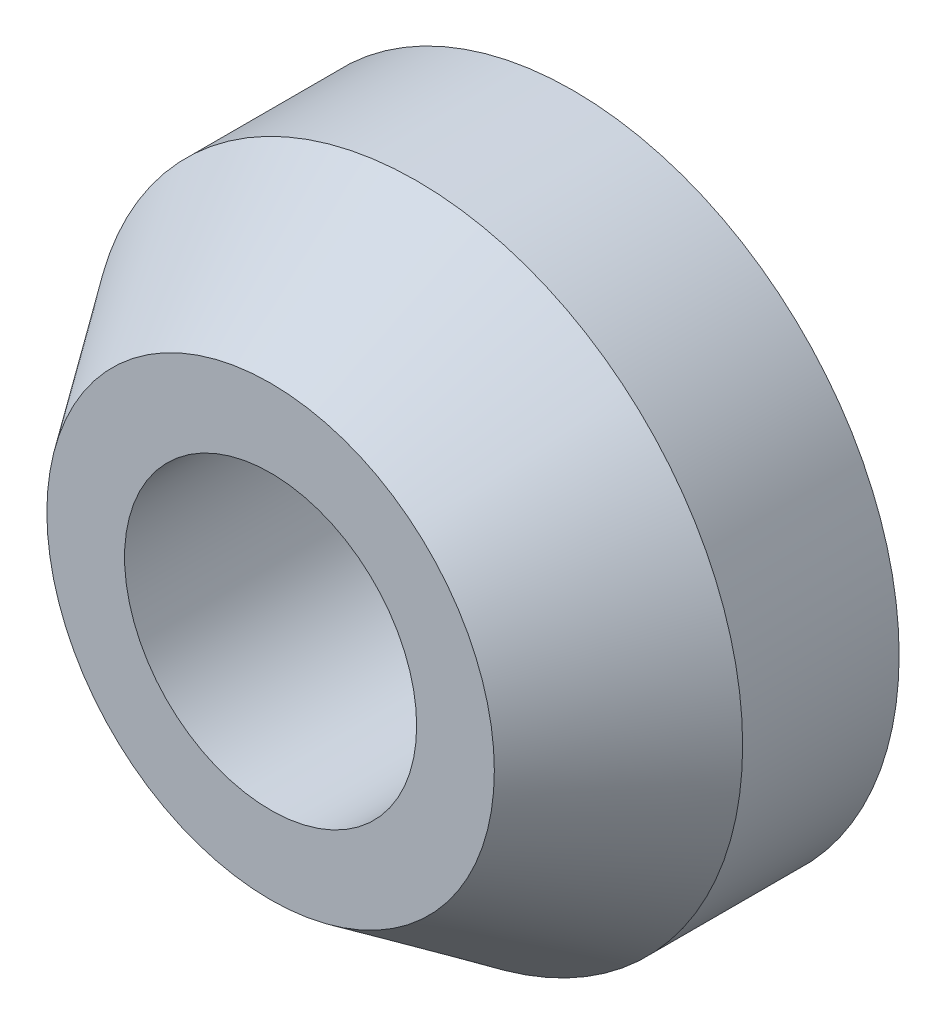
from build123d import *

# Parameters (mm, degrees)
SKETCH1_R      = 3.175
EXTRUDE1_DEPTH = 2.9464
SKETCH2_R      = 1.4224
EXTRUDE2_DEPTH = 6.370523528
CHAMFER1_SIZE  = 1.4224
CHAMFER1_SIZE2 = 0.995975202


with BuildPart() as part:
    # Sketch1 → Extrude1 (new body)
    with BuildSketch(Plane.XY):
        Circle(SKETCH1_R)
    extrude(amount=EXTRUDE1_DEPTH)

    # Sketch2 → Extrude2 (cut, through all)
    with BuildSketch(Plane.XY.offset(2.9464)):
        Circle(SKETCH2_R)
    extrude(amount=-EXTRUDE2_DEPTH, mode=Mode.SUBTRACT)

    # Chamfer1
    chamfer1_edges = [part.edges().sort_by_distance(p)[0] for p in [
        (-3.175, 0, 2.9464),
    ]]
    chamfer1_side = [part.faces().sort_by_distance(p)[0] for p in [
        (-3.175, 0, 1.4732),
    ]]
    chamfer(chamfer1_edges, length=CHAMFER1_SIZE, length2=CHAMFER1_SIZE2, reference=chamfer1_side[0])


solid = part.part
